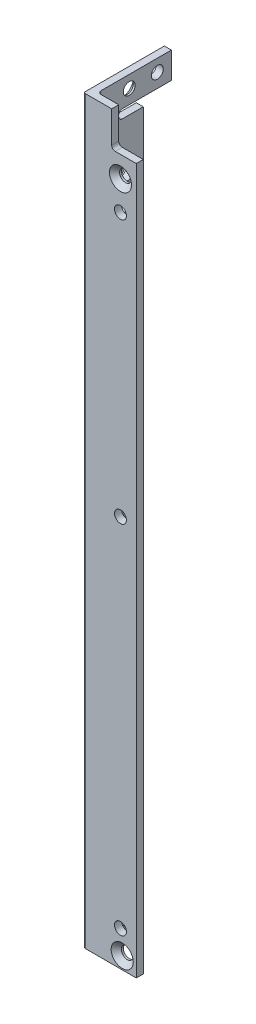
from build123d import *

# Parameters (mm, degrees)
BOSS_EXTRUDE1_DEPTH                             = 211
CSK_FOR_M3_FLAT_HEAD_MACHINE_SCREW1_D           = 3.4
CSK_FOR_M3_FLAT_HEAD_MACHINE_SCREW1_CSINK_D     = 6.3
CSK_FOR_M3_FLAT_HEAD_MACHINE_SCREW1_CSINK_ANGLE = 90
SKETCH6_W                                       = 7
SKETCH6_H                                       = 10
CUT_EXTRUDE1_DEPTH                              = 213.063669684
SKETCH7_W                                       = 7
SKETCH7_H                                       = 2.5
CUT_EXTRUDE2_DEPTH                              = 213.063669684
CSK_FOR_M3_FLAT_HEAD_MACHINE_SCREW2_D           = 3.4
CSK_FOR_M3_FLAT_HEAD_MACHINE_SCREW2_CSINK_D     = 6.3
CSK_FOR_M3_FLAT_HEAD_MACHINE_SCREW2_CSINK_ANGLE = 90
CSK_FOR_M3_FLAT_HEAD_MACHINE_SCREW3_D           = 3.4
CSK_FOR_M3_FLAT_HEAD_MACHINE_SCREW3_CSINK_D     = 6.3
CSK_FOR_M3_FLAT_HEAD_MACHINE_SCREW3_CSINK_ANGLE = 90
FILLET1_R                                       = 0.5
FILLET2_R                                       = 1
CUT_EXTRUDE3_START                              = -10
SKETCH16_R                                      = 1.7
CUT_EXTRUDE3_DEPTH                              = 10
CUT_EXTRUDE4_START                              = -10
SKETCH17_R                                      = 1.7
CUT_EXTRUDE4_DEPTH                              = 10
SKETCH20_W                                      = 2
SKETCH20_H                                      = 7.5
BOSS_EXTRUDE2_DEPTH                             = 8
SKETCH21_R                                      = 1.7
CUT_EXTRUDE5_DEPTH                              = 3


with BuildPart() as part:
    # Sketch1 → Boss-Extrude1 (new body)
    with BuildSketch(Plane(origin=(0, 0, 0), x_dir=(1, 0, 0), z_dir=(0, 1, 0))):
        Polygon((0, 15), (0, 0), (15, 0), (15, 2), (2, 2), (2, 15), align=None)
    extrude(amount=BOSS_EXTRUDE1_DEPTH)

    # CSK for M3 Flat Head Machine Screw1 (through all)
    with Locations(Plane.ZY):
        with Locations((-10.5, 178.5483), (-10.5, 150.81169946), (-10.5, 125.12070188), (-10.5, 91.71900188), (-10.5, 32.45070188), (-10.5, 79.86070188), (-10.5, 137.8117)):
            CounterSinkHole(CSK_FOR_M3_FLAT_HEAD_MACHINE_SCREW1_D / 2, CSK_FOR_M3_FLAT_HEAD_MACHINE_SCREW1_CSINK_D / 2, counter_sink_angle=CSK_FOR_M3_FLAT_HEAD_MACHINE_SCREW1_CSINK_ANGLE)

    # Sketch6 → Cut-Extrude1 (cut, through all)
    with BuildSketch(Plane.XY):
        with Locations((11.5, 206)):
            Rectangle(SKETCH6_W, SKETCH6_H)
    extrude(amount=-CUT_EXTRUDE1_DEPTH, mode=Mode.SUBTRACT)

    # Sketch7 → Cut-Extrude2 (cut, through all)
    with BuildSketch(Plane.ZY):
        with Locations((-11.5, 202.25)):
            Rectangle(SKETCH7_W, SKETCH7_H)
    extrude(amount=-CUT_EXTRUDE2_DEPTH, mode=Mode.SUBTRACT)

    # CSK for M3 Flat Head Machine Screw2 (through all)
    with Locations(Plane.ZY):
        with Locations((-11, 207.5)):
            CounterSinkHole(CSK_FOR_M3_FLAT_HEAD_MACHINE_SCREW2_D / 2, CSK_FOR_M3_FLAT_HEAD_MACHINE_SCREW2_CSINK_D / 2, counter_sink_angle=CSK_FOR_M3_FLAT_HEAD_MACHINE_SCREW2_CSINK_ANGLE)

    # CSK for M3 Flat Head Machine Screw3 (through all)
    with Locations(Plane.XY):
        with Locations((11, 3.5), (10.5, 195)):
            CounterSinkHole(CSK_FOR_M3_FLAT_HEAD_MACHINE_SCREW3_D / 2, CSK_FOR_M3_FLAT_HEAD_MACHINE_SCREW3_CSINK_D / 2, counter_sink_angle=CSK_FOR_M3_FLAT_HEAD_MACHINE_SCREW3_CSINK_ANGLE)

    # Fillet1
    fillet1_edges = [part.edges().sort_by_distance(p)[0] for p in [
        (0, 105.5, 0),
    ]]
    fillet(fillet1_edges, radius=FILLET1_R)

    # Fillet2
    fillet2_edges = [part.edges().sort_by_distance(p)[0] for p in [
        (2, 105.5, -2),
        (8, 201, -1),
        (1, 203.5, -8),
        (1, 201, -8),
    ]]
    fillet(fillet2_edges, radius=FILLET2_R)

    # Sketch16 → Cut-Extrude3 (cut)
    with BuildSketch(Plane.ZY.offset(CUT_EXTRUDE3_START)):
        with Locations((-10.5, 186.68)):
            Circle(SKETCH16_R)
        with Locations((-10.5, 111.59)):
            Circle(SKETCH16_R)
        with Locations((-10.5, 3)):
            Circle(SKETCH16_R)
        with Locations((-10.5, 178.5483)):
            Circle(SKETCH16_R)
    extrude(amount=CUT_EXTRUDE3_DEPTH, mode=Mode.SUBTRACT)

    # Sketch17 → Cut-Extrude4 (cut)
    with BuildSketch(Plane.XY.offset(CUT_EXTRUDE4_START)):
        with Locations((10.5, 186.68)):
            Circle(SKETCH17_R)
        with Locations((10.5, 111.59)):
            Circle(SKETCH17_R)
        with Locations((10.5, 10)):
            Circle(SKETCH17_R)
        with Locations((10.5, 195)):
            Circle(SKETCH17_R)
    extrude(amount=CUT_EXTRUDE4_DEPTH, mode=Mode.SUBTRACT)

    # Sketch20 → Boss-Extrude2 (add)
    with BuildSketch(Plane(origin=(0, 0, -15), x_dir=(-1, 0, 0), z_dir=(0, 0, -1))):
        with Locations((-1, 207.25)):
            Rectangle(SKETCH20_W, SKETCH20_H)
    extrude(amount=BOSS_EXTRUDE2_DEPTH)

    # Sketch21 → Cut-Extrude5 (cut)
    with BuildSketch(Plane(origin=(2, 0, 0), x_dir=(0, 0, -1), z_dir=(1, 0, 0))):
        with Locations((19, 207.5)):
            Circle(SKETCH21_R)
    extrude(amount=-CUT_EXTRUDE5_DEPTH, mode=Mode.SUBTRACT)


solid = part.part
